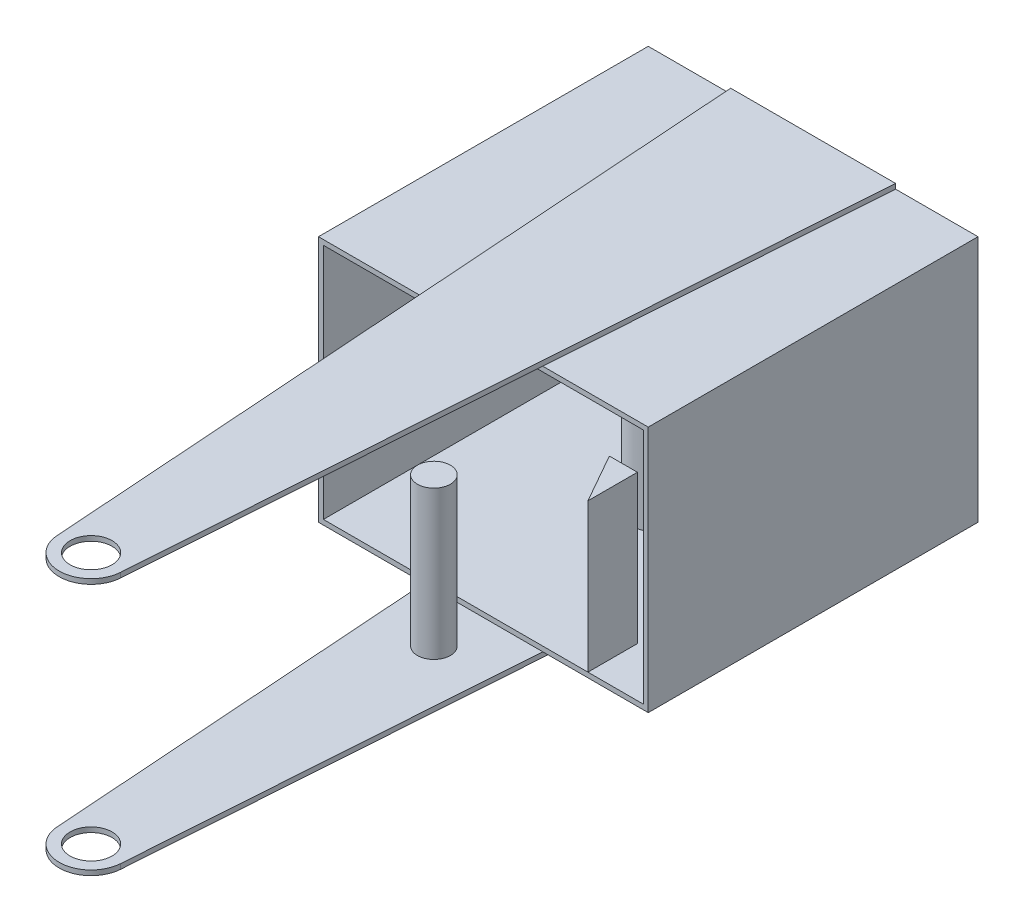
from build123d import *

# Parameters (mm, degrees)
CROQUIS1_W              = 200
CROQUIS1_H              = 150
SALIENTE_EXTRUIR1_DEPTH = 200
VACIADO1_T              = -3
CROQUIS2_R              = 12.7
SALIENTE_EXTRUIR2_DEPTH = 3
CROQUIS4_R              = 15
SALIENTE_EXTRUIR3_DEPTH = 90
CROQUIS6_R              = 10
SALIENTE_EXTRUIR4_DEPTH = 90
SALIENTE_EXTRUIR5_DEPTH = 90


with BuildPart() as part:
    # Croquis1 → Saliente-Extruir1 (new body)
    with BuildSketch(Plane.XY):
        with Locations((100, 75)):
            Rectangle(CROQUIS1_W, CROQUIS1_H)
    extrude(amount=SALIENTE_EXTRUIR1_DEPTH)

    # Vaciado1
    vaciado1_openings = [part.faces().sort_by_distance(p)[0] for p in [
        (100, 75, 200),
    ]]
    offset(amount=VACIADO1_T, openings=vaciado1_openings, kind=Kind.INTERSECTION)

    # Croquis2 → Saliente-Extruir2 (add)
    with BuildSketch(Plane(origin=(0, 150, 0), x_dir=(1, 0, 0), z_dir=(0, 1, 0))):
        with BuildLine():
            Line((150, 0), (50, 0))
            Line((50, 0), (80.716237825, -439.262665799))
            ThreePointArc((80.716237825, -439.262665799), (100, -457.245064944), (119.283762175, -439.262665799))
            Line((119.283762175, -439.262665799), (150, 0))
        make_face()
        with Locations(Location((100, -437.914213787, 0), (0, 0, 90))):
            Circle(CROQUIS2_R, mode=Mode.SUBTRACT)
    saliente_extruir2 = extrude(amount=SALIENTE_EXTRUIR2_DEPTH)

    # Simetría1: Saliente-Extruir2 across plane
    add(saliente_extruir2.mirror(Plane(origin=(0, 75, 0), x_dir=(0, 0, 1), z_dir=(0, -1, 0))))

    # Croquis4 → Saliente-Extruir3 (add)
    with BuildSketch(Plane(origin=(0, 3, 0), x_dir=(1, 0, 0), z_dir=(0, 1, 0))):
        with Locations(Location((100, -95, 0), (0, 0, 90))):
            Circle(CROQUIS4_R)
    extrude(amount=SALIENTE_EXTRUIR3_DEPTH)

    # Croquis6 → Saliente-Extruir4 (add)
    with BuildSketch(Plane(origin=(0, 0, 0), x_dir=(1, 0, 0), z_dir=(0, 1, 0))):
        with Locations(Location((100, -230, 0), (0, 0, 90))):
            Circle(CROQUIS6_R)
    extrude(amount=SALIENTE_EXTRUIR4_DEPTH)

    # Croquis7 → Saliente-Extruir5 (add)
    with BuildSketch(Plane(origin=(0, 3, 0), x_dir=(1, 0, 0), z_dir=(0, 1, 0))):
        Polygon((146.429598438, -170), (163.429598438, -170), (163.429598438, -200), align=None)
    extrude(amount=SALIENTE_EXTRUIR5_DEPTH)


solid = part.part
